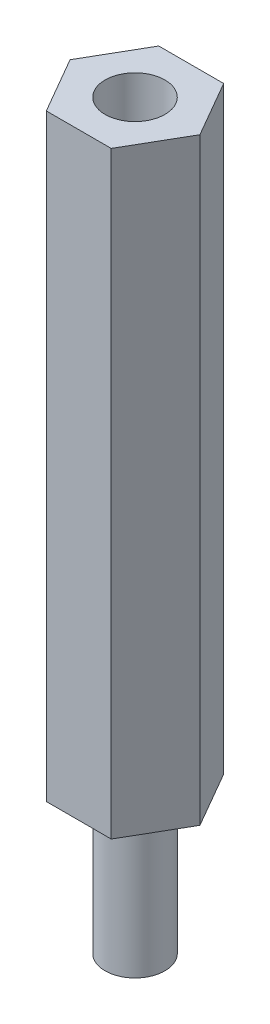
from build123d import *

# Parameters (mm, degrees)
SKETCH1_R                = 1.25
BOSS_EXTRUDE1_DEPTH      = 25
BOSS_EXTRUDE3_DEPTH      = 19
BOSS_EXTRUDE3_DEPTH_BACK = 6
SKETCH2_R                = 1.25


with BuildPart() as part:
    # Sketch1 → Boss-Extrude1 (new body)
    with BuildSketch(Plane(origin=(0, 0, 0), x_dir=(1, 0, 0), z_dir=(0, 1, 0))):
        Polygon((1.356773133, 2.35), (-1.356773133, 2.35), (-2.713546265, 0), (-1.356773133, -2.35), (1.356773133, -2.35), (2.713546265, 0), align=None)
        with Locations(Location((0, 0, 0), (0, 0, 270))):
            Circle(SKETCH1_R, mode=Mode.SUBTRACT)
    extrude(amount=BOSS_EXTRUDE1_DEPTH)

    # Sketch2 → Boss-Extrude3 (add, two sides: drawn at the far end of the back side and taken through both)
    with BuildSketch(Plane(origin=(0, 0, 0), x_dir=(1, 0, 0), z_dir=(0, 1, 0)).offset(-BOSS_EXTRUDE3_DEPTH_BACK)):
        with Locations(Location((0, 0, 0), (0, 0, 270))):
            Circle(SKETCH2_R)
    extrude(amount=BOSS_EXTRUDE3_DEPTH + BOSS_EXTRUDE3_DEPTH_BACK)


solid = part.part
